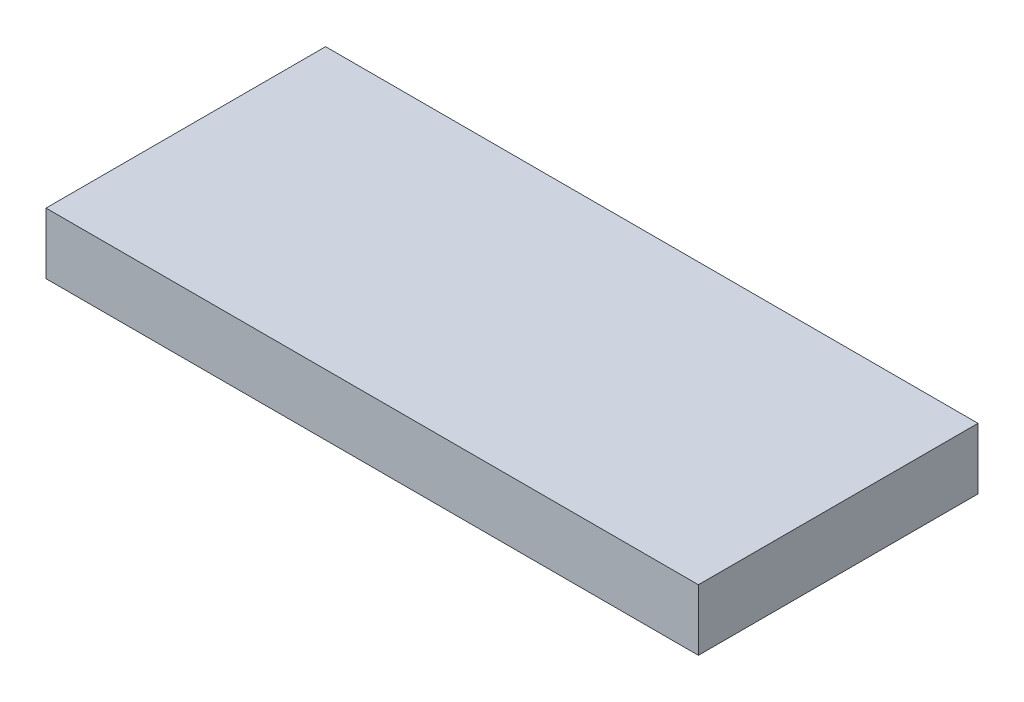
from build123d import *

# Parameters (mm, degrees)
SKETCH_1_W      = 53.34
SKETCH_1_H      = 22.86
EXTRUDE_1_DEPTH = 5


with BuildPart() as part:
    # 草圖1 → 填料-伸長1 (new body)
    with BuildSketch(Plane(origin=(0, 0, 0), x_dir=(1, 0, 0), z_dir=(0, 1, 0))):
        Rectangle(SKETCH_1_W, SKETCH_1_H)
    extrude(amount=EXTRUDE_1_DEPTH)


solid = part.part
